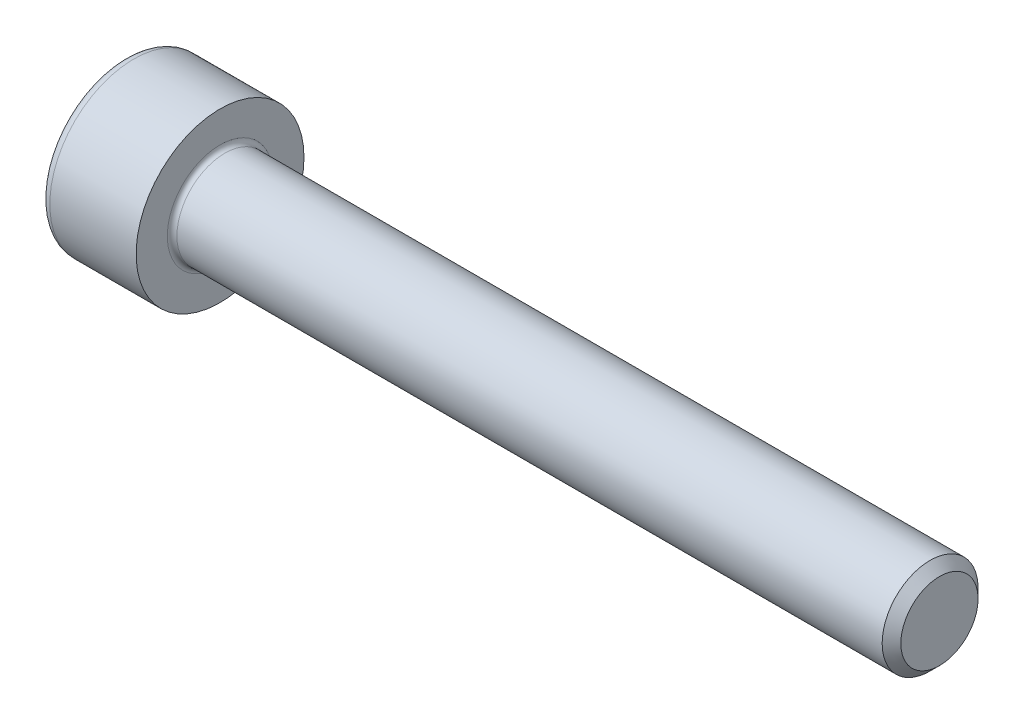
from build123d import *

# Parameters (mm, degrees)
BASEHEADSKE_R   = 3.5
BASEHEAD_DEPTH  = 4
CUTSOCKET_DEPTH = 2
FILLET1_R       = 0.2
FILLET2_R       = 0.4


with BuildPart() as part:
    # BaseHeadSke → BaseHead (new body)
    with BuildSketch(Plane(origin=(0, 0, 0), x_dir=(0, 0, -1), z_dir=(1, 0, 0))):
        Circle(BASEHEADSKE_R)
    extrude(amount=BASEHEAD_DEPTH)

    # BodySke → BaseBody (revolve)
    with BuildSketch(Plane.XY, mode=Mode.PRIVATE) as basebody_sk:
        Polygon((0, 0), (34, 0), (34, 1.61), (33.61, 2), (0, 2), align=None)
    revolve(basebody_sk.sketch.rotate(Axis((0, 0, 0), (1, 0, 0)), 90), axis=Axis((0, 0, 0), (1, 0, 0)))

    # CutSocketSke → CutSocket (cut)
    with BuildSketch(Plane(origin=(0, 0, 0), x_dir=(0, 0, -1), z_dir=(1, 0, 0))):
        Polygon((0, 1.732050808), (-1.5, 0.866025404), (-1.5, -0.866025404), (0, -1.732050808), (1.5, -0.866025404), (1.5, 0.866025404), align=None)
    extrude(amount=CUTSOCKET_DEPTH, mode=Mode.SUBTRACT)

    # CutHoleSke → CutHole (revolve, cut)
    with BuildSketch(Plane.XY, mode=Mode.PRIVATE) as cuthole_sk:
        Polygon((0, 1.5), (2.6, 1.5), (3.466025404, 0), (0, 0), align=None)
    revolve(cuthole_sk.sketch.rotate(Axis((0, 0, 0), (1, 0, 0)), 90), axis=Axis((0, 0, 0), (1, 0, 0)), mode=Mode.SUBTRACT)

    # Fillet1
    fillet1_edges = [part.edges().sort_by_distance(p)[0] for p in [
        (4, 0, -2),
    ]]
    fillet(fillet1_edges, radius=FILLET1_R)

    # Fillet2
    fillet2_edges = [part.edges().sort_by_distance(p)[0] for p in [
        (0, 0, 3.5),
    ]]
    fillet(fillet2_edges, radius=FILLET2_R)


solid = part.part
